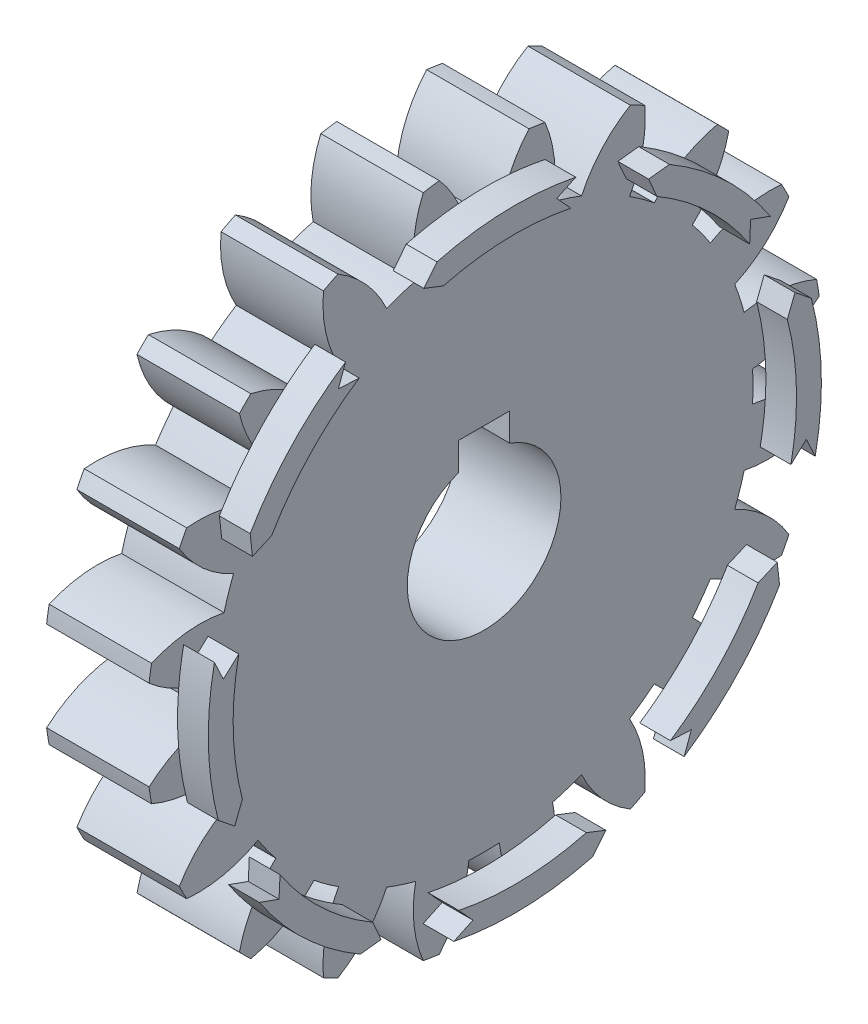
from build123d import *

# Parameters (mm, degrees)
BASPROSKE_W         = 10
BASPROSKE_H         = 33
TOOTHCUT_DEPTH      = 48.728398255
TEETHCUTS_COUNT     = 20
TEETHCUTS_ANGLE     = 342
BORSKE_R            = 7.5
BORE_DEPTH          = 50.0009652
KEYSKE_W            = 5
KEYSKE_H            = 9.8
KEYWAY_DEPTH        = 50.0009652
BOSS_EXTRUDE1_DEPTH = 3
CIRPATTERN1_COUNT   = 8


with BuildPart() as part:
    # BasProSke → Base-Revolve (revolve)
    with BuildSketch(Plane(origin=(0, 0, 0), x_dir=(1, 0, 0), z_dir=(0, 1, 0)), mode=Mode.PRIVATE) as base_revolve_sk:
        with Locations((5, 16.5)):
            Rectangle(BASPROSKE_W, BASPROSKE_H)
    revolve(base_revolve_sk.sketch.rotate(Axis((-10, 0, 0), (1, 0, 0)), 180), axis=Axis((-10, 0, 0), (1, 0, 0)))

    # TooCutSke → ToothCut (cut, through all)
    with BuildSketch(Plane(origin=(0, 0, 0), x_dir=(0, 0, -1), z_dir=(1, 0, 0))):
        with BuildLine():
            ThreePointArc((1.489278925, 26.206717637), (0, 26.249), (-1.489278925, 26.206717637))
            ThreePointArc((-1.489278925, 26.206717637), (-2.448651415, 29.690511169), (-4.401620335, 32.730762038))
            ThreePointArc((-4.401620335, 32.730762038), (0, 33.0254), (4.401620335, 32.730762038))
            ThreePointArc((4.401620335, 32.730762038), (2.448651415, 29.690511169), (1.489278925, 26.206717637))
        make_face()
    toothcut = extrude(amount=TOOTHCUT_DEPTH, mode=Mode.SUBTRACT)

    # TeethCuts: ToothCut ×20 about axis
    teethcuts_axis = Axis((-10, 0, 0), (1, 0, 0))
    for i in range(1, TEETHCUTS_COUNT):
        add(toothcut.rotate(teethcuts_axis, i * TEETHCUTS_ANGLE / (TEETHCUTS_COUNT - 1)), mode=Mode.SUBTRACT)

    # BorSke → Bore (cut, symmetric)
    with BuildSketch(Plane(origin=(0, 0, 0), x_dir=(0, 0, -1), z_dir=(1, 0, 0))):
        with Locations(Location((0, 0, 0), (0, 0, 180))):
            Circle(BORSKE_R)
    extrude(amount=BORE_DEPTH, both=True, mode=Mode.SUBTRACT)

    # KeySke → Keyway (cut, symmetric)
    with BuildSketch(Plane(origin=(0, 0, 0), x_dir=(0, 0, -1), z_dir=(1, 0, 0))):
        with Locations((0, 4.9)):
            Rectangle(KEYSKE_W, KEYSKE_H)
    extrude(amount=KEYWAY_DEPTH, both=True, mode=Mode.SUBTRACT)

    # Sketch1 → Boss-Extrude1 (add)
    with BuildSketch(Plane(origin=(10, 0, 0), x_dir=(0, 0, -1), z_dir=(1, 0, 0))):
        with BuildLine():
            ThreePointArc((-16.529956881, 24.945263088), (-17.237932279, 24.461384175), (-17.931752295, 23.957418154))
            Line((-17.931752295, 23.957418154), (-17.227665112, 23.016734234))
            Line((-17.227665112, 23.016734234), (-16.529956881, 24.945263088))
        make_face()
        with BuildLine():
            Line((-17.227665112, 23.016734234), (-16.478636194, 22.016006658))
            ThreePointArc((-16.478636194, 22.016006658), (-15.841040523, 22.479133327), (-15.190436566, 22.923800665))
            Line((-15.190436566, 22.923800665), (-17.227665112, 23.016734234))
        make_face()
        with BuildLine():
            ThreePointArc((-17.931752295, 23.957418154), (-22.329920459, 19.921854263), (-25.839643669, 15.093655622))
            Line((-25.839643669, 15.093655622), (-24.825054486, 14.501005819))
            ThreePointArc((-24.825054486, 14.501005819), (-21.453139957, 19.139626067), (-17.227665112, 23.016734234))
            Line((-17.227665112, 23.016734234), (-17.931752295, 23.957418154))
        make_face()
        with BuildLine():
            Line((-24.825054486, 14.501005819), (-23.745704291, 13.870527305))
            ThreePointArc((-23.745704291, 13.870527305), (-20.520394741, 18.307468412), (-16.478636194, 22.016006658))
            Line((-16.478636194, 22.016006658), (-17.227665112, 23.016734234))
            ThreePointArc((-17.227665112, 23.016734234), (-21.453139957, 19.139626067), (-24.825054486, 14.501005819))
        make_face()
        with BuildLine():
            Line((-25.839643669, 15.093655622), (-25.614951523, 13.055142989))
            ThreePointArc((-25.614951523, 13.055142989), (-25.230362292, 13.783733842), (-24.825054486, 14.501005819))
            Line((-24.825054486, 14.501005819), (-25.839643669, 15.093655622))
        make_face()
        with BuildLine():
            ThreePointArc((-24.825054486, 14.501005819), (-25.230362292, 13.783733842), (-25.614951523, 13.055142989))
            Line((-25.614951523, 13.055142989), (-23.745704291, 13.870527305))
            Line((-23.745704291, 13.870527305), (-24.825054486, 14.501005819))
        make_face()
    boss_extrude1 = extrude(amount=BOSS_EXTRUDE1_DEPTH)

    # CirPattern1: Boss-Extrude1 ×8 about axis
    cirpattern1_axis = Axis((0, 0, 0), (1, 0, 0))
    for i in range(1, CIRPATTERN1_COUNT):
        add(boss_extrude1.rotate(cirpattern1_axis, i * 360 / CIRPATTERN1_COUNT))


solid = part.part
